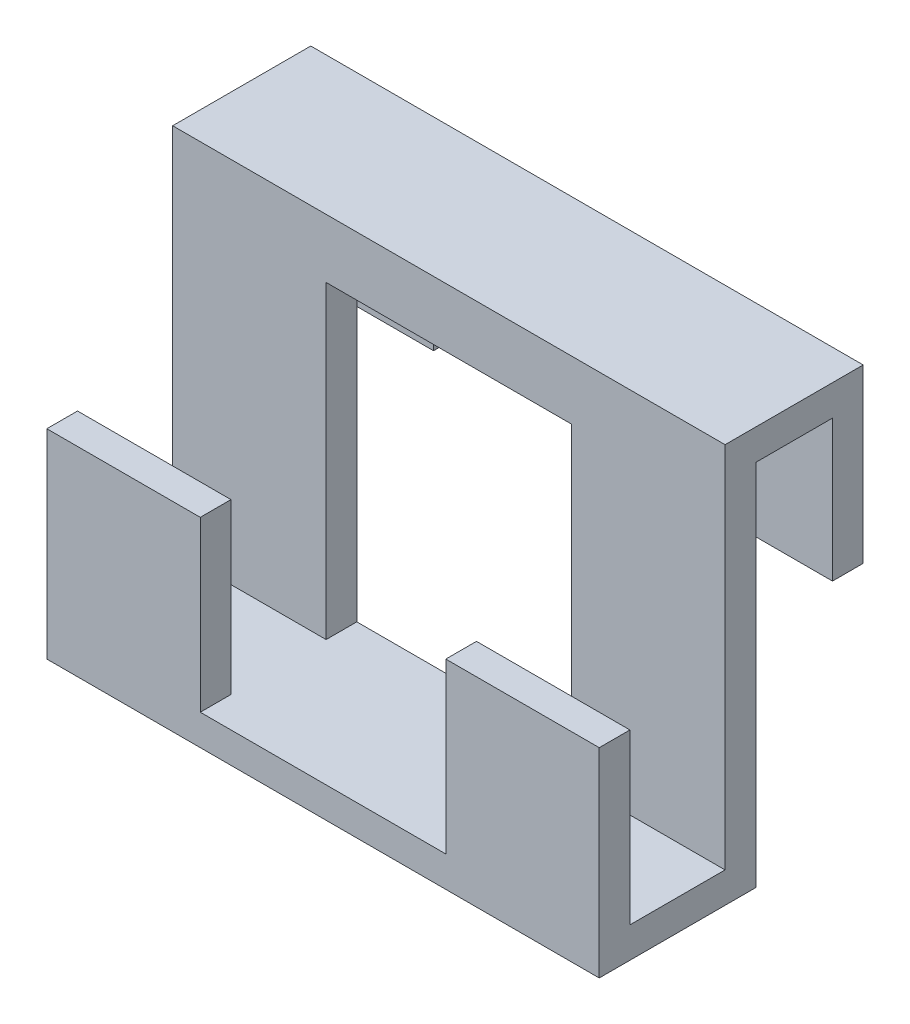
from build123d import *

# Parameters (mm, degrees)
BOSS_EXTRUDE1_DEPTH     = 180
CUT_EXTRUDE1_DEPTH      = 202.244874193
CUT_EXTRUDE1_DEPTH_BACK = 202.244874193
SKETCH3_W               = 80
SKETCH3_H               = 100.784598353


with BuildPart() as part:
    # Sketch1 → Boss-Extrude1 (new body)
    with BuildSketch(Plane(origin=(0, 0, 0), x_dir=(0, 0, -1), z_dir=(1, 0, 0))):
        Polygon((41.824095604, 42.060925147), (41.824095604, -3.939074853), (51.824095604, -3.939074853), (51.824095604, 52.060925147), (6.824095604, 52.060925147), (6.824095604, -77.939074853), (16.824095604, -77.939074853), (16.824095604, 42.060925147), align=None)
        Polygon((6.824095604, -77.939074853), (6.824095604, -67.939074853), (-24.175904396, -67.939074853), (-24.175904396, -12.939074853), (-34.175904396, -12.939074853), (-34.175904396, -77.939074853), align=None)
    extrude(amount=BOSS_EXTRUDE1_DEPTH)

    # Sketch3 → Cut-Extrude1 (cut, two sides: drawn at the far end of the back side and taken through both)
    with BuildSketch(Plane.XY.offset(-6.824095604).offset(-CUT_EXTRUDE1_DEPTH_BACK)):
        with Locations((90, -17.546775677)):
            Rectangle(SKETCH3_W, SKETCH3_H)
    extrude(amount=CUT_EXTRUDE1_DEPTH + CUT_EXTRUDE1_DEPTH_BACK, mode=Mode.SUBTRACT)


solid = part.part
